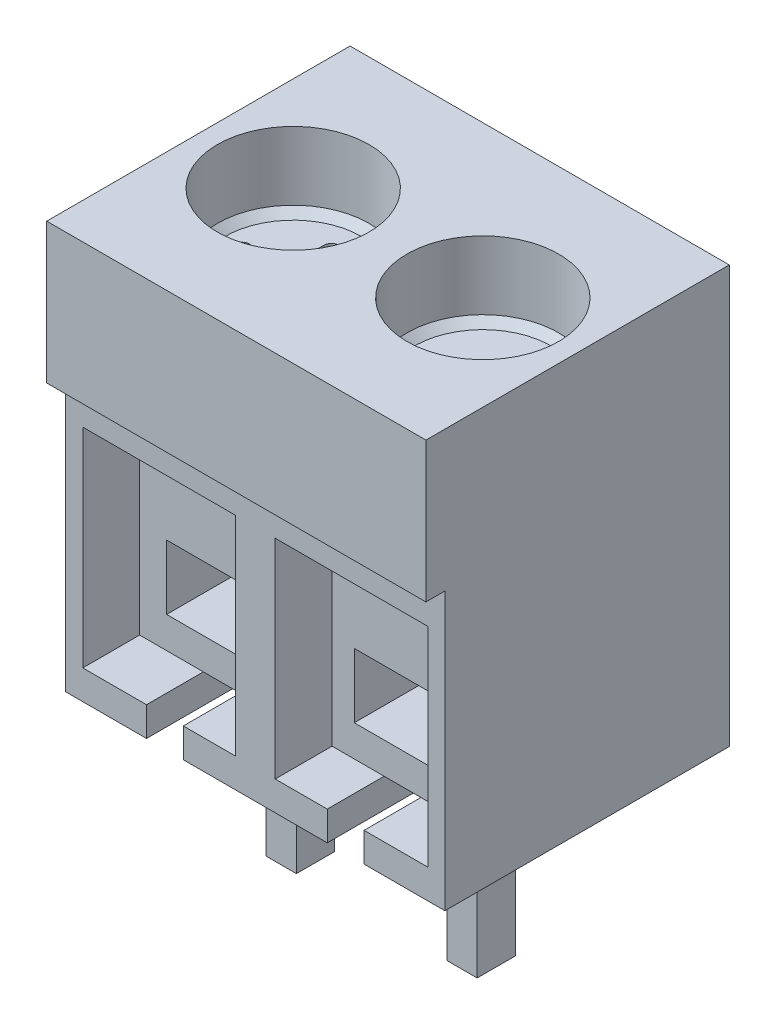
from build123d import *

# Parameters (mm, degrees)
CROQUIS1_W                      = 10
CROQUIS1_H                      = 11
SALIENTE_EXTRUIR1_DEPTH         = 8
CROQUIS2_R                      = 2
CORTAR_EXTRUIR1_DEPTH           = 2
CROQUIS3_W                      = 10
CROQUIS3_H                      = 7.302971928
CORTAR_EXTRUIR2_DEPTH           = 0.5
CROQUIS4_W                      = 4.024100916
CROQUIS4_H                      = 5.499604586
CORTAR_EXTRUIR3_DEPTH           = 1.5
CROQUIS5_W                      = 2.727446176
CROQUIS5_H                      = 1.699064831
CORTAR_EXTRUIR4_DEPTH           = 3.5
CORTAR_EXTRUIR5_DEPTH           = 1
CORTAR_EXTRUIR5_DRAFT           = -3
CORTAR_EXTRUIR5_PROFILE_2_DEPTH = 1
CORTAR_EXTRUIR5_PROFILE_2_DRAFT = -3
CHAFL_N1_SIZE                   = 0.2
CORTAR_EXTRUIR6_DEPTH           = 11.559356041
CROQUIS8_W                      = 0.8
CROQUIS8_H                      = 1.009702069
SALIENTE_EXTRUIR2_DEPTH         = 5
CHAFL_N2_SIZE                   = 0.05


with BuildPart() as part:
    # Croquis1 → Saliente-Extruir1 (new body)
    with BuildSketch(Plane.XY):
        Rectangle(CROQUIS1_W, CROQUIS1_H)
    extrude(amount=SALIENTE_EXTRUIR1_DEPTH)

    # Croquis2 → Cortar-Extruir1 (cut)
    with BuildSketch(Plane(origin=(0, 5.5, 0), x_dir=(1, 0, 0), z_dir=(0, 1, 0))):
        with Locations(Location((2.5, -4, 0), (0, 0, 270))):
            Circle(CROQUIS2_R)
        with Locations(Location((-2.5, -4, 0), (0, 0, 90))):
            Circle(CROQUIS2_R)
    extrude(amount=-CORTAR_EXTRUIR1_DEPTH, mode=Mode.SUBTRACT)

    # Croquis3 → Cortar-Extruir2 (cut)
    with BuildSketch(Plane.XY.offset(8)):
        with Locations((0, -1.848514036)):
            Rectangle(CROQUIS3_W, CROQUIS3_H)
    extrude(amount=-CORTAR_EXTRUIR2_DEPTH, mode=Mode.SUBTRACT)

    # Croquis4 → Cortar-Extruir3 (cut)
    with BuildSketch(Plane.XY.offset(7.5)):
        with Locations((-2.537419189, -1.978516284)):
            Rectangle(CROQUIS4_W, CROQUIS4_H)
        with Locations((2.537419189, -1.978516284)):
            Rectangle(CROQUIS4_W, CROQUIS4_H)
    extrude(amount=-CORTAR_EXTRUIR3_DEPTH, mode=Mode.SUBTRACT)

    # Croquis5 → Cortar-Extruir4 (cut)
    with BuildSketch(Plane.XY.offset(6)):
        with Locations((-2.474433562, -3.051609862)):
            Rectangle(CROQUIS5_W, CROQUIS5_H)
        with Locations((2.474433562, -3.051609862)):
            Rectangle(CROQUIS5_W, CROQUIS5_H)
    extrude(amount=-CORTAR_EXTRUIR4_DEPTH, mode=Mode.SUBTRACT)


with BuildPart() as cortar_extruir5_tool:
    # Croquis6 → Cortar-Extruir5 (with draft: the straight prism first)
    with BuildSketch(Plane(origin=(0, 3.5, 0), x_dir=(1, 0, 0), z_dir=(0, 1, 0))):
        with BuildLine():
            Line((-2.796040432, -4.215779763), (-2.796040432, -5.17015319))
            ThreePointArc((-2.796040432, -5.17015319), (-2.592982256, -5.373211365), (-2.38992408, -5.17015319))
            Line((-2.38992408, -5.17015319), (-2.38992408, -4.215779763))
            Line((-2.38992408, -4.215779763), (-1.374633201, -4.215779763))
            ThreePointArc((-1.374633201, -4.215779763), (-1.191880843, -4.033027405), (-1.374633201, -3.850275046))
            Line((-1.374633201, -3.850275046), (-2.38992408, -3.850275046))
            Line((-2.38992408, -3.850275046), (-2.38992408, -2.89590162))
            ThreePointArc((-2.38992408, -2.89590162), (-2.592982256, -2.692843444), (-2.796040432, -2.89590162))
            Line((-2.796040432, -2.89590162), (-2.796040432, -3.850275046))
            Line((-2.796040432, -3.850275046), (-3.811331312, -3.850275046))
            ThreePointArc((-3.811331312, -3.850275046), (-3.99408367, -4.033027405), (-3.811331312, -4.215779763))
            Line((-3.811331312, -4.215779763), (-2.796040432, -4.215779763))
        make_face()
    extrude(amount=-CORTAR_EXTRUIR5_DEPTH)
    # Cortar-Extruir5: the draft: its side faces are tilted about the plane it starts from
    cortar_extruir5_sides = [cortar_extruir5_tool.faces().sort_by_distance(p)[0] for p in [
        (-2.796040432, 3, 3.373088333),
        (-3.303685872, 3, 3.850275046),
        (-3.99408367, 3, 4.033027405),
        (-3.303685872, 3, 4.215779763),
        (-2.796040432, 3, 4.692966476),
        (-2.592982256, 3, 5.373211365),
        (-2.38992408, 3, 4.692966476),
        (-1.882278641, 3, 4.215779763),
        (-1.191880843, 3, 4.033027405),
        (-1.882278641, 3, 3.850275046),
        (-2.38992408, 3, 3.373088333),
        (-2.592982256, 3, 2.692843444),
    ]]
    draft(cortar_extruir5_sides, Plane(origin=(0, 3.5, 0), x_dir=(1, 0, 0), z_dir=(0, 1, 0)), CORTAR_EXTRUIR5_DRAFT)


with BuildPart() as part_1:
    add(part.part)

    # Cortar-Extruir5: cut by cortar_extruir5_tool
    add(cortar_extruir5_tool.part, mode=Mode.SUBTRACT)


with BuildPart() as cortar_extruir5_profile_2_tool:
    # Croquis6 → Cortar-Extruir5 profile 2 (with draft: the straight prism first)
    with BuildSketch(Plane(origin=(0, 3.5, 0), x_dir=(1, 0, 0), z_dir=(0, 1, 0))):
        with BuildLine():
            Line((2.38992408, -4.215779763), (2.38992408, -5.17015319))
            ThreePointArc((2.38992408, -5.17015319), (2.592982256, -5.373211365), (2.796040432, -5.17015319))
            Line((2.796040432, -5.17015319), (2.796040432, -4.215779763))
            Line((2.796040432, -4.215779763), (3.811331312, -4.215779763))
            ThreePointArc((3.811331312, -4.215779763), (3.99408367, -4.033027405), (3.811331312, -3.850275046))
            Line((3.811331312, -3.850275046), (2.796040432, -3.850275046))
            Line((2.796040432, -3.850275046), (2.796040432, -2.89590162))
            ThreePointArc((2.796040432, -2.89590162), (2.592982256, -2.692843444), (2.38992408, -2.89590162))
            Line((2.38992408, -2.89590162), (2.38992408, -3.850275046))
            Line((2.38992408, -3.850275046), (1.374633201, -3.850275046))
            ThreePointArc((1.374633201, -3.850275046), (1.191880843, -4.033027405), (1.374633201, -4.215779763))
            Line((1.374633201, -4.215779763), (2.38992408, -4.215779763))
        make_face()
    extrude(amount=-CORTAR_EXTRUIR5_PROFILE_2_DEPTH)
    # Cortar-Extruir5 profile 2: the draft: its side faces are tilted about the plane it starts from
    cortar_extruir5_profile_2_sides = [cortar_extruir5_profile_2_tool.faces().sort_by_distance(p)[0] for p in [
        (2.38992408, 3, 4.692966476),
        (2.592982256, 3, 5.373211365),
        (2.796040432, 3, 4.692966476),
        (3.303685872, 3, 4.215779763),
        (3.99408367, 3, 4.033027405),
        (3.303685872, 3, 3.850275046),
        (2.796040432, 3, 3.373088333),
        (2.592982256, 3, 2.692843444),
        (2.38992408, 3, 3.373088333),
        (1.882278641, 3, 3.850275046),
        (1.191880843, 3, 4.033027405),
        (1.882278641, 3, 4.215779763),
    ]]
    draft(cortar_extruir5_profile_2_sides, Plane(origin=(0, 3.5, 0), x_dir=(1, 0, 0), z_dir=(0, 1, 0)), CORTAR_EXTRUIR5_PROFILE_2_DRAFT)


with BuildPart() as part_2:
    add(part_1.part)

    # Cortar-Extruir5 profile 2: cut by cortar_extruir5_profile_2_tool
    add(cortar_extruir5_profile_2_tool.part, mode=Mode.SUBTRACT)

    # Chaflán1
    chafl_n1_edges = [part_2.edges().sort_by_distance(p)[0] for p in [
        (2.5, 3.5, 2),
        (-2.5, 3.5, 6),
    ]]
    chamfer(chafl_n1_edges, length=CHAFL_N1_SIZE)

    # Croquis7 → Cortar-Extruir6 (cut, through all)
    with BuildSketch(Plane.XY.offset(7.5)):
        Polygon((-2.869109202, -5.079330001), (-2.869109202, -5.629900541), (-1.898102979, -5.629900541), (-1.898102979, -5.079330001), (-1.898102979, -4.728318577), (-2.869109202, -4.728318577), align=None)
        Polygon((2.869109202, -4.728318577), (2.869109202, -5.079330001), (2.869109202, -5.629900541), (1.898102979, -5.629900541), (1.898102979, -5.079330001), (1.898102979, -4.728318577), align=None)
    extrude(amount=-CORTAR_EXTRUIR6_DEPTH, mode=Mode.SUBTRACT)

    # Croquis8 → Saliente-Extruir2 (add)
    with BuildSketch(Plane.XZ.offset(4.728318577)):
        with Locations((-2.383102979, 3.926715173)):
            Rectangle(CROQUIS8_W, CROQUIS8_H)
        with Locations((2.383102979, 3.926715173)):
            Rectangle(CROQUIS8_W, CROQUIS8_H)
    extrude(amount=SALIENTE_EXTRUIR2_DEPTH)

    # Chaflán2
    chafl_n2_edges = [part_2.edges().sort_by_distance(p)[0] for p in [
        (-1.983102979, -9.728318577, 3.926715172),
        (-2.383102979, -9.728318577, 4.431566207),
        (-2.783102979, -9.728318577, 3.926715172),
        (-2.383102979, -9.728318577, 3.421864138),
        (2.783102979, -9.728318577, 3.926715172),
        (2.383102979, -9.728318577, 4.431566207),
        (1.983102979, -9.728318577, 3.926715172),
        (2.383102979, -9.728318577, 3.421864138),
    ]]
    chamfer(chafl_n2_edges, length=CHAFL_N2_SIZE)


solid = part_2.part
